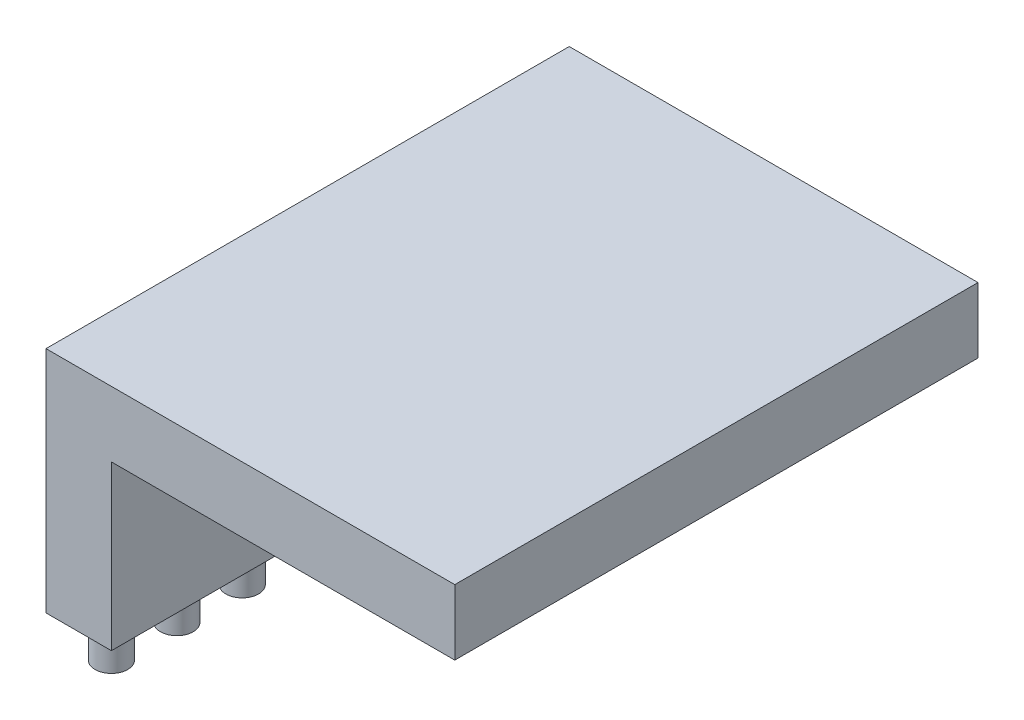
from build123d import *

# Parameters (mm, degrees)
SKETCH1_W           = 15.875
SKETCH1_H           = 20.32
BOSS_EXTRUDE1_DEPTH = 2.54
SKETCH2_W           = 2.54
SKETCH2_H           = 20.32
BOSS_EXTRUDE2_DEPTH = 6.35
SKETCH3_R           = 0.635
BOSS_EXTRUDE3_DEPTH = 1.5875


with BuildPart() as part:
    # Sketch1 → Boss-Extrude1 (new body)
    with BuildSketch(Plane(origin=(0, 0, 0), x_dir=(1, 0, 0), z_dir=(0, 1, 0))):
        with Locations((-7.9375, 10.16)):
            Rectangle(SKETCH1_W, SKETCH1_H)
    extrude(amount=BOSS_EXTRUDE1_DEPTH)

    # Sketch2 → Boss-Extrude2 (add)
    with BuildSketch(Plane.XZ):
        with Locations((-14.605, -10.16)):
            Rectangle(SKETCH2_W, SKETCH2_H)
    extrude(amount=BOSS_EXTRUDE2_DEPTH)

    # Sketch3 → Boss-Extrude3 (add)
    with BuildSketch(Plane.XZ.offset(6.35)):
        with Locations(Location((-14.605, -1.27, 0), (0, 0, 270))):
            Circle(SKETCH3_R)
        with Locations(Location((-14.605, -3.81, 0), (0, 0, 270))):
            Circle(SKETCH3_R)
        with Locations(Location((-14.605, -6.35, 0), (0, 0, 270))):
            Circle(SKETCH3_R)
        with Locations(Location((-14.605, -8.89, 0), (0, 0, 270))):
            Circle(SKETCH3_R)
        with Locations(Location((-14.605, -11.43, 0), (0, 0, 270))):
            Circle(SKETCH3_R)
        with Locations(Location((-14.605, -13.97, 0), (0, 0, 270))):
            Circle(SKETCH3_R)
        with Locations(Location((-14.605, -16.51, 0), (0, 0, 270))):
            Circle(SKETCH3_R)
        with Locations(Location((-14.605, -19.05, 0), (0, 0, 270))):
            Circle(SKETCH3_R)
    extrude(amount=BOSS_EXTRUDE3_DEPTH)


solid = part.part
